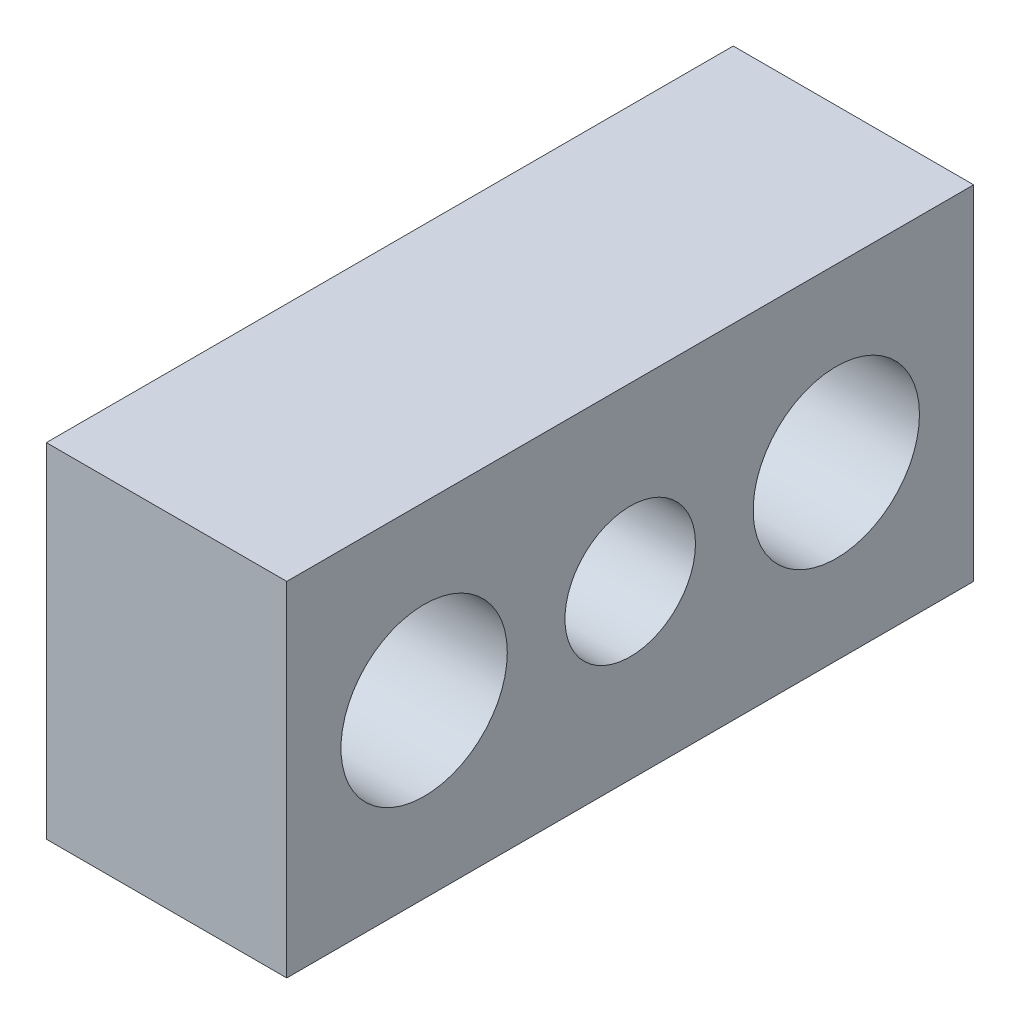
from build123d import *

# Parameters (mm, degrees)
SKETCH1_W           = 20
SKETCH1_H           = 10
SKETCH1_R           = 1.9
SKETCH1_R_2         = 2.421524664
BOSS_EXTRUDE1_DEPTH = 7


with BuildPart() as part:
    # Sketch1 → Boss-Extrude1 (new body)
    with BuildSketch(Plane(origin=(0, 0, 0), x_dir=(0, 0, -1), z_dir=(1, 0, 0))):
        with Locations((10, 5)):
            Rectangle(SKETCH1_W, SKETCH1_H)
        with Locations((10, 5)):
            Circle(SKETCH1_R, mode=Mode.SUBTRACT)
        with Locations((16, 5)):
            Circle(SKETCH1_R_2, mode=Mode.SUBTRACT)
        with Locations((4, 5)):
            Circle(SKETCH1_R_2, mode=Mode.SUBTRACT)
    extrude(amount=BOSS_EXTRUDE1_DEPTH)


solid = part.part
